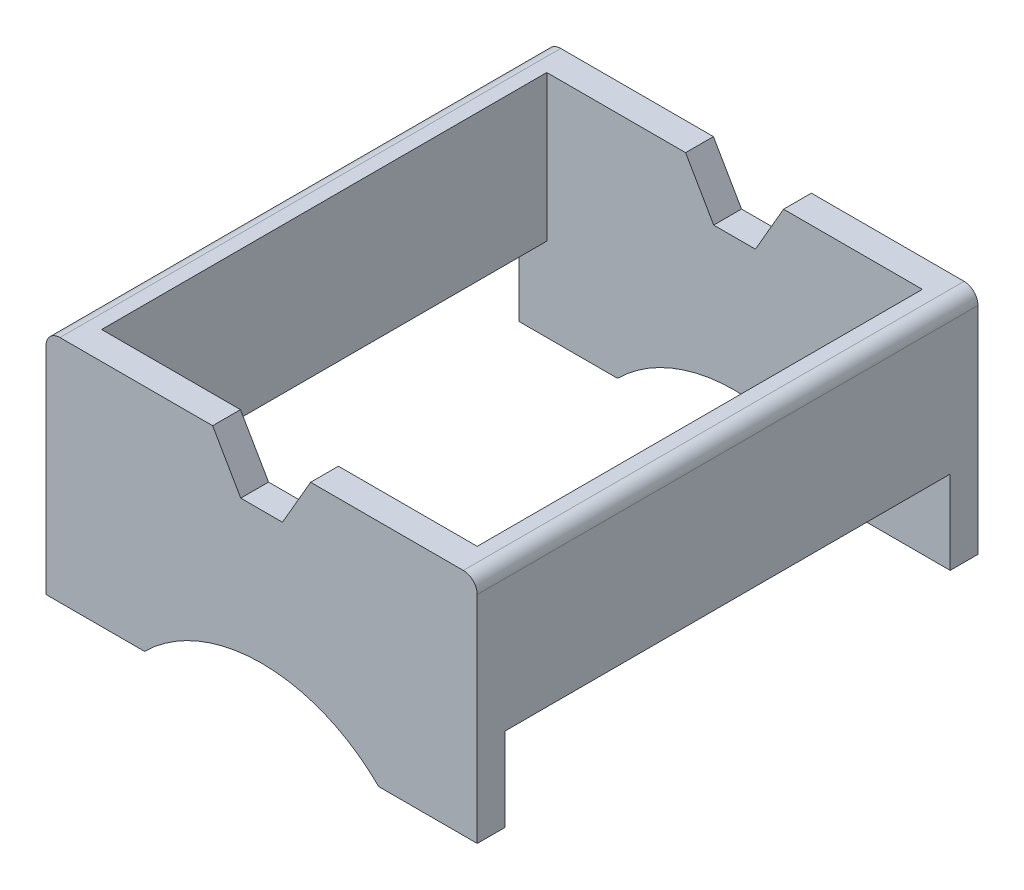
from build123d import *

# Parameters (mm, degrees)
SKETCH1_W               = 31
SKETCH1_H               = 36
SKETCH1_W_2             = 27
SKETCH1_H_2             = 32
EXTRUDE1_DEPTH          = 16.5
SKETCH2_W               = 32
SKETCH2_H               = 6
CUT_EXTRUDE1_DEPTH      = 40.462007045
CUT_EXTRUDE2_DEPTH      = 43.52646235
FILLET1_R               = 1
CUT_EXTRUDE4_DEPTH      = 43.52646235
CUT_EXTRUDE4_DEPTH_BACK = 43.52646235


with BuildPart() as part:
    # Sketch1 → Extrude1 (new body)
    with BuildSketch(Plane(origin=(0, 0, 0), x_dir=(1, 0, 0), z_dir=(0, 1, 0))):
        Rectangle(SKETCH1_W, SKETCH1_H)
        Rectangle(SKETCH1_W_2, SKETCH1_H_2, mode=Mode.SUBTRACT)
    extrude(amount=EXTRUDE1_DEPTH)

    # Sketch2 → Cut-Extrude1 (cut, through all)
    with BuildSketch(Plane.ZY.offset(15.5)):
        with Locations((0, 3)):
            Rectangle(SKETCH2_W, SKETCH2_H)
    extrude(amount=-CUT_EXTRUDE1_DEPTH, mode=Mode.SUBTRACT)

    # Sketch3 → Cut-Extrude2 (cut, through all)
    with BuildSketch(Plane(origin=(0, 0, -18), x_dir=(-1, 0, 0), z_dir=(0, 0, -1))):
        Polygon((-3.520725942, 16.5), (3.520725942, 16.5), (1.5, 13), (-1.5, 13), align=None)
    extrude(amount=-CUT_EXTRUDE2_DEPTH, mode=Mode.SUBTRACT)

    # Fillet1
    fillet1_edges = [part.edges().sort_by_distance(p)[0] for p in [
        (15.5, 16.5, 0),
        (-15.5, 16.5, 0),
    ]]
    fillet(fillet1_edges, radius=FILLET1_R)

    # Sketch4 → Cut-Extrude4 (cut, two sides: drawn at the far end of the back side and taken through both)
    with BuildSketch(Plane(origin=(0, 0, -18), x_dir=(-1, 0, 0), z_dir=(0, 0, -1)).offset(-CUT_EXTRUDE4_DEPTH_BACK)):
        with BuildLine():
            Line((-56.695317872, -48.043906057), (-8.415960011, 0))
            ThreePointArc((-8.415960011, 0), (0, 3.47396015), (8.415960011, 0))
            Line((8.415960011, 0), (56.695317872, -48.043906057))
            Line((56.695317872, -48.043906057), (56.695317872, -184.265979228))
            Line((56.695317872, -184.265979228), (-56.695317872, -184.265979228))
            Line((-56.695317872, -184.265979228), (-56.695317872, -48.043906057))
        make_face()
    extrude(amount=CUT_EXTRUDE4_DEPTH + CUT_EXTRUDE4_DEPTH_BACK, mode=Mode.SUBTRACT)


solid = part.part
